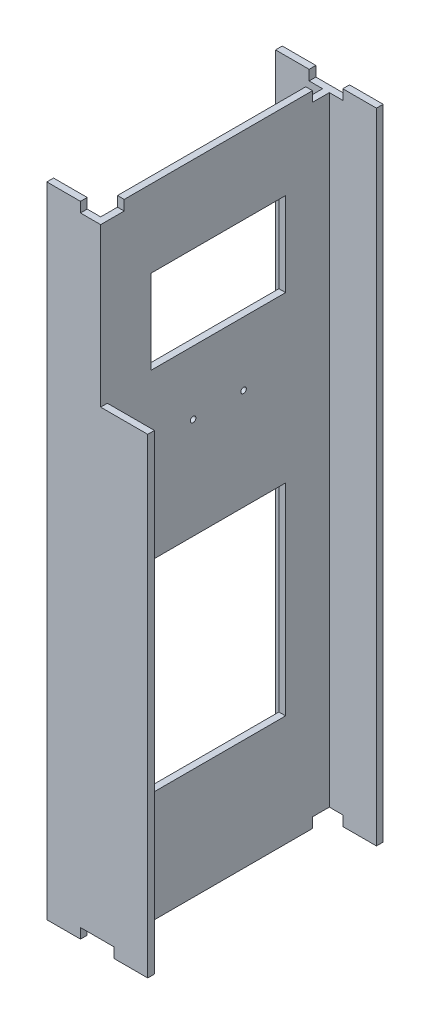
from build123d import *

# Parameters (mm, degrees)
BOSS_EXTRUDE1_DEPTH = 95
SKETCH3_W           = 10
SKETCH3_H           = 10
CUT_EXTRUDE2_DEPTH  = 3
SKETCH4_W           = 40
SKETCH4_H           = 25
SKETCH4_H_2         = 60
CUT_EXTRUDE8_DEPTH  = 2
SKETCH5_W           = 14
SKETCH5_H           = 50
CUT_EXTRUDE9_DEPTH  = 2
SKETCH6_R           = 0.825
CUT_EXTRUDE10_DEPTH = 203.435174809


with BuildPart() as part:
    # Sketch1 → Boss-Extrude1 (new body)
    with BuildSketch(Plane(origin=(0, 0, 0), x_dir=(1, 0, 0), z_dir=(0, 1, 0))):
        Polygon((0, 0), (0, 66), (14, 66), (14, 68), (-16, 68), (-16, 66), (-2, 66), (-2, 0), (-16, 0), (-16, -2), (14, -2), (14, 0), align=None)
    extrude(amount=BOSS_EXTRUDE1_DEPTH)

    # Sketch3 → Cut-Extrude2 (cut)
    with BuildSketch(Plane.XZ):
        with Locations((-1, 0)):
            Rectangle(SKETCH3_W, SKETCH3_H)
        with Locations((-1, -66)):
            Rectangle(SKETCH3_W, SKETCH3_H)
    extrude(amount=-CUT_EXTRUDE2_DEPTH, mode=Mode.SUBTRACT)

    # Mirror2: part across plane


with BuildPart() as part_1:
    add(part.part)
    add(part.part.mirror(Plane(origin=(0, 95, 0), x_dir=(0, 0, 1), z_dir=(0, -1, 0))))

    # Sketch4 → Cut-Extrude8 (cut)
    with BuildSketch(Plane.ZY.offset(2)):
        with Locations((-33, 154.5)):
            Rectangle(SKETCH4_W, SKETCH4_H)
        with Locations((-33, 63)):
            Rectangle(SKETCH4_W, SKETCH4_H_2)
    extrude(amount=-CUT_EXTRUDE8_DEPTH, mode=Mode.SUBTRACT)

    # Sketch5 → Cut-Extrude9 (cut)
    with BuildSketch(Plane(origin=(0, 0, 0), x_dir=(-1, 0, 0), z_dir=(0, 0, -1))):
        with Locations((-7, 165)):
            Rectangle(SKETCH5_W, SKETCH5_H)
    extrude(amount=-CUT_EXTRUDE9_DEPTH, mode=Mode.SUBTRACT)

    # Sketch6 → Cut-Extrude10 (cut, through all)
    with BuildSketch(Plane.ZY.offset(2)):
        with Locations((-25.5, 123.074804834)):
            Circle(SKETCH6_R)
        with Locations((-40.5, 123.074804834)):
            Circle(SKETCH6_R)
    extrude(amount=-CUT_EXTRUDE10_DEPTH, mode=Mode.SUBTRACT)


solid = part_1.part
